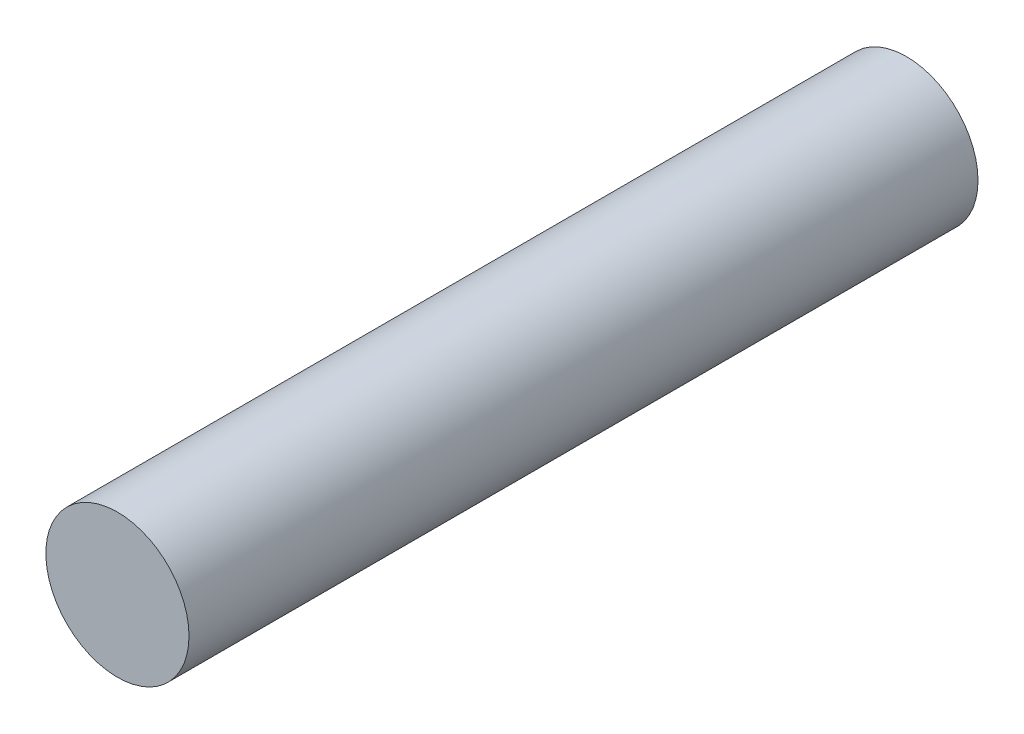
from build123d import *

# Parameters (mm, degrees)
SKETCH1_R           = 6.35
BOSS_EXTRUDE1_DEPTH = 35


with BuildPart() as part:
    # Sketch1 → Boss-Extrude1 (new, symmetric)
    with BuildSketch(Plane.XY):
        Circle(SKETCH1_R)
    extrude(amount=BOSS_EXTRUDE1_DEPTH, both=True)


solid = part.part
